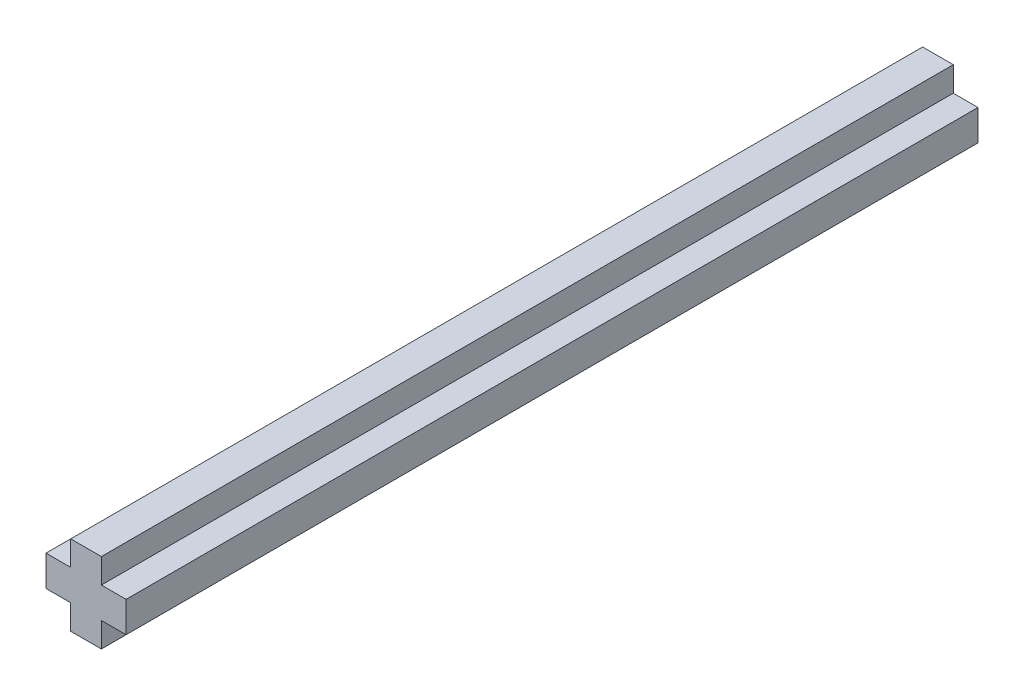
from build123d import *

# Parameters (mm, degrees)
EXTRUDE_1_DEPTH = 50


with BuildPart() as part:
    # 草图1 → 凸台-拉伸1 (new body)
    with BuildSketch(Plane.XY):
        Polygon((-0.9, 2.35), (-0.9, 0.9), (-2.35, 0.9), (-2.35, -0.9), (-0.9, -0.9), (-0.9, -2.35), (0.9, -2.35), (0.9, -0.9), (2.35, -0.9), (2.35, 0.9), (0.9, 0.9), (0.9, 2.35), align=None)
    extrude(amount=EXTRUDE_1_DEPTH)


solid = part.part
